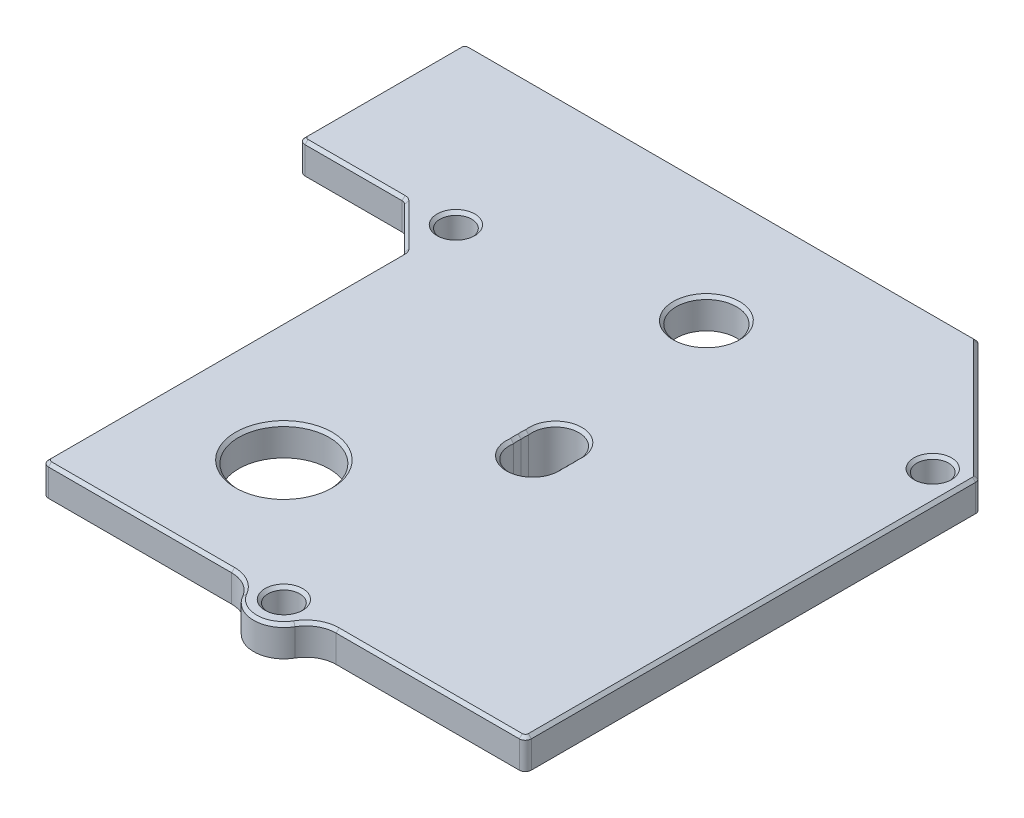
from build123d import *

# Parameters (mm, degrees)
EXTRUDE_1_DEPTH     = 2
SKETCH_2_R          = 3.5
EXTRUDE_2_DEPTH     = 5.7
CUT_EXTRUDE_START   = -4.7
CUT_EXTRUDE_1_DEPTH = 4.7
SKETCH_5_R          = 1.05
CUT_EXTRUDE_2_DEPTH = 10
SKETCH_6_R          = 2
EXTRUDE_3_DEPTH     = 2
FILLET_1_R          = 2
SKETCH_7_R          = 1.05
CUT_EXTRUDE_3_DEPTH = 2
FILLET_2_R          = 0.4
CHAMFER_1_SIZE      = 2
CHAMFER_2_SIZE      = 0.4
SKETCH_8_R          = 3
SKETCH_8_R_2        = 2
CUT_EXTRUDE_5_DEPTH = 51.37135361
CHAMFER_3_SIZE      = 0.2


with BuildPart() as part:
    # 草图1 → 凸台-拉伸1 (new body)
    with BuildSketch(Plane(origin=(0, 0, 0), x_dir=(1, 0, 0), z_dir=(0, 1, 0))):
        Polygon((0.701628422, -0.113501573), (0.701628422, 23.886498427), (-2.298371578, 26.886498427), (-9.298371578, 26.886498427), (-9.298371578, 37.886498427), (24.701628422, 37.886498427), (32.701628422, 29.886498427), (32.701628422, -0.113501573), align=None)
    extrude(amount=EXTRUDE_1_DEPTH)

    # 草图2 → 凸台-拉伸2 (add)
    with BuildSketch(Plane.XZ):
        with Locations(Location((16.701628422, -17.136498427, 0), (0, 0, 270))):
            Circle(SKETCH_2_R)
        with BuildLine():
            ThreePointArc((15.171922568, -17.636498427), (16.701628422, -19.436498427), (18.231334277, -17.636498427))
            ThreePointArc((18.231334277, -17.636498427), (18.251628422, -17.386498427), (18.231334277, -17.136498427))
            ThreePointArc((18.231334277, -17.136498427), (18.251628422, -16.886498427), (18.231334277, -16.636498427))
            ThreePointArc((18.231334277, -16.636498427), (16.701628422, -14.836498427), (15.171922568, -16.636498427))
            ThreePointArc((15.171922568, -16.636498427), (15.151628422, -16.886498427), (15.171922568, -17.136498427))
            ThreePointArc((15.171922568, -17.136498427), (15.151628422, -17.386498427), (15.171922568, -17.636498427))
        make_face(mode=Mode.SUBTRACT)
    extrude(amount=EXTRUDE_2_DEPTH)

    # 草图3 → 切除-拉伸1 (cut)
    with BuildSketch(Plane.XZ.offset(CUT_EXTRUDE_START)):
        with BuildLine():
            ThreePointArc((15.171922568, -17.136498427), (15.151628422, -17.386498427), (15.171922568, -17.636498427))
            ThreePointArc((15.171922568, -17.636498427), (16.701628422, -19.436498427), (18.231334277, -17.636498427))
            ThreePointArc((18.231334277, -17.636498427), (18.251628422, -17.386498427), (18.231334277, -17.136498427))
            ThreePointArc((18.231334277, -17.136498427), (18.251628422, -16.886498427), (18.231334277, -16.636498427))
            ThreePointArc((18.231334277, -16.636498427), (16.701628422, -14.836498427), (15.171922568, -16.636498427))
            ThreePointArc((15.171922568, -16.636498427), (15.151628422, -16.886498427), (15.171922568, -17.136498427))
        make_face()
    extrude(amount=CUT_EXTRUDE_1_DEPTH, mode=Mode.SUBTRACT)

    # 草图5 → 切除-拉伸2 (cut)
    with BuildSketch(Plane.XZ):
        with Locations(Location((30.701628422, -28.886498427, 0), (0, 0, 270))):
            Circle(SKETCH_5_R)
        with Locations(Location((0.901628422, -27.086498427, 0), (0, 0, 270))):
            Circle(SKETCH_5_R)
    extrude(amount=-CUT_EXTRUDE_2_DEPTH, mode=Mode.SUBTRACT)

    # 草图6 → 凸台-拉伸3 (add)
    with BuildSketch(Plane(origin=(0, 0, 0), x_dir=(-1, 0, 0), z_dir=(0, -1, 0))):
        with Locations((-16.701628422, -0.113501573)):
            Circle(SKETCH_6_R)
    extrude(amount=-EXTRUDE_3_DEPTH)

    # 圆角1
    fillet_1_edges = [part.edges().sort_by_distance(p)[0] for p in [
        (18.701628422, 1, 0.113501573),
        (14.701628422, 1, 0.113501573),
    ]]
    fillet(fillet_1_edges, radius=FILLET_1_R)

    # 草图7 → 切除-拉伸3 (cut)
    with BuildSketch(Plane(origin=(0, 2, 0), x_dir=(1, 0, 0), z_dir=(0, 1, 0))):
        with Locations(Location((16.701628422, -0.113501573, 0), (0, 0, 270))):
            Circle(SKETCH_7_R)
    extrude(amount=-CUT_EXTRUDE_3_DEPTH, mode=Mode.SUBTRACT)

    # 圆角2
    fillet_2_edges = [part.edges().sort_by_distance(p)[0] for p in [
        (0.701628422, 1, 0.113501573),
        (0.701628422, 1, -23.886498427),
        (-2.298371578, 1, -26.886498427),
        (-9.298371578, 1, -26.886498427),
        (-9.298371578, 1, -37.886498427),
        (24.701628422, 1, -37.886498427),
        (32.701628422, 1, -29.886498427),
        (32.701628422, 1, 0.113501573),
    ]]
    fillet(fillet_2_edges, radius=FILLET_2_R)

    # 倒角1
    chamfer_1_edges = [part.edges().sort_by_distance(p)[0] for p in [
        (16.701628422, 0, -13.636498427),
    ]]
    chamfer(chamfer_1_edges, length=CHAMFER_1_SIZE)

    # 倒角2
    chamfer_2_edges = [part.edges().sort_by_distance(p)[0] for p in [
        (16.701628422, -5.7, -13.636498427),
    ]]
    chamfer(chamfer_2_edges, length=CHAMFER_2_SIZE)

    # 草图8 → 切除-拉伸5 (cut, through all)
    with BuildSketch(Plane.XZ):
        with Locations(Location((8.701628422, -7.886498427, 0), (0, 0, 270))):
            Circle(SKETCH_8_R)
        with Locations(Location((14.701628422, -29.886498427, 0), (0, 0, 270))):
            Circle(SKETCH_8_R_2)
    extrude(amount=-CUT_EXTRUDE_5_DEPTH, mode=Mode.SUBTRACT)

    # 倒角3
    chamfer_3_edges = [part.edges().sort_by_distance(p)[0] for p in [
        (26.23367923, 2, 0.113501573),
        (16.701628422, 2, 2.113501573),
        (19.165730038, 2, 0.381450765),
        (14.237526807, 2, 0.381450765),
        (16.701628422, 2, -0.936498427),
        (7.81878571, 2, -37.886498427),
        (28.701628422, 2, -33.886498427),
        (7.169577615, 2, 0.113501573),
        (32.701628422, 2, -15.003655715),
        (-9.298371578, 2, -32.386498427),
        (-5.68121429, 2, -26.886498427),
        (-0.798371578, 2, -25.386498427),
        (0.701628422, 2, -12.003655715),
        (-9.18121429, 2, -27.003655715),
        (-9.18121429, 2, -37.769341139),
        (0.81878571, 2, -0.003655715),
        (32.584471135, 2, -0.003655715),
        (32.671180235, 2, -29.873886375),
        (24.68901637, 2, -37.85605024),
        (0.671180235, 2, -23.873886375),
        (-2.31098363, 2, -26.85605024),
        (8.701628422, 2, -4.886498427),
        (14.701628422, 2, -27.886498427),
        (16.701628422, 2, -19.436498427),
        (18.251628422, 2, -17.386498427),
        (18.251628422, 2, -16.886498427),
        (16.701628422, 2, -14.836498427),
        (15.151628422, 2, -16.886498427),
        (15.151628422, 2, -17.386498427),
        (30.701628422, 2, -27.836498427),
        (0.901628422, 2, -26.036498427),
    ]]
    chamfer(chamfer_3_edges, length=CHAMFER_3_SIZE)


solid = part.part
